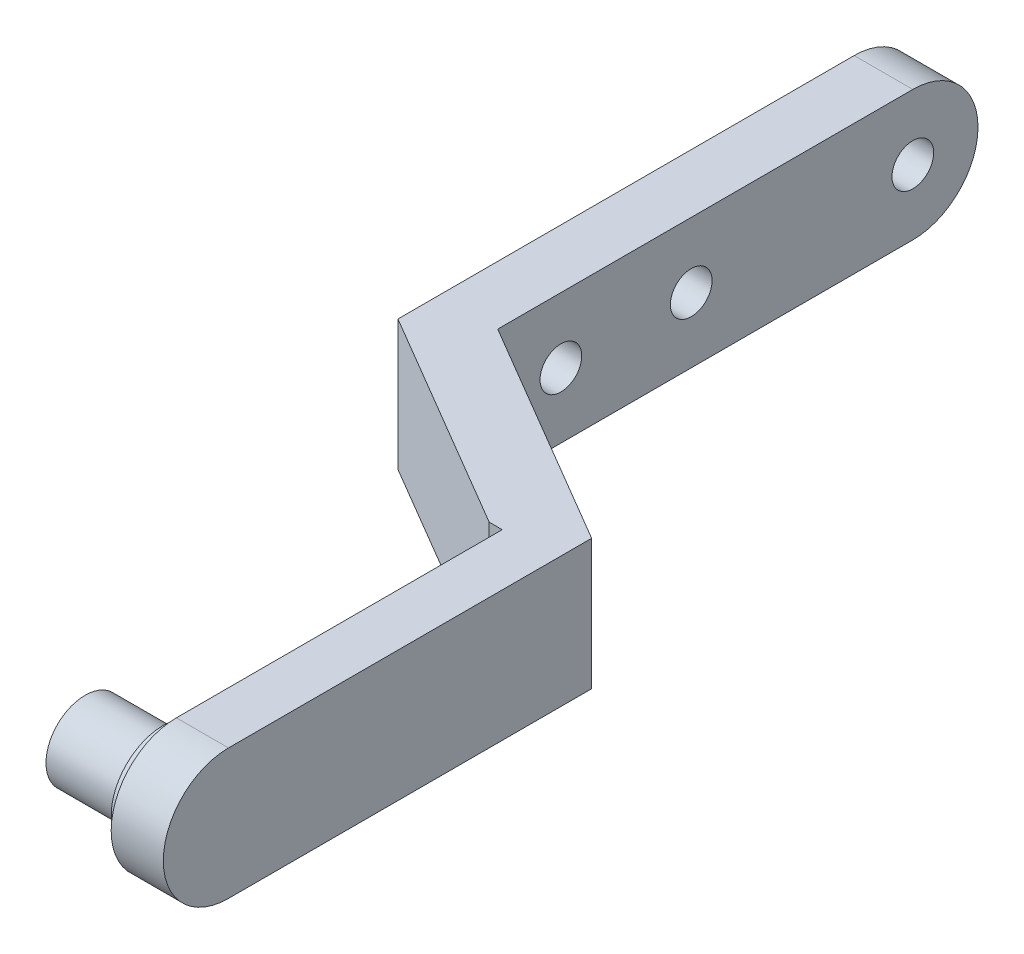
from build123d import *

# Parameters (mm, degrees)
EXTRUDE_2_DEPTH          = 5
CUT_EXTRUDE_1_DEPTH      = 83.044195407
CUT_EXTRUDE_1_DEPTH_BACK = 83.044195407
SKETCH_3_OUTSIDE_W       = 98.714
SKETCH_3_OUTSIDE_H       = 28.714
CUT_EXTRUDE_2_DEPTH      = 84.120394609
CUT_EXTRUDE_2_DEPTH_BACK = 84.120394609
SKETCH_4_R               = 1.6
SKETCH_5_R               = 3
EXTRUDE_4_DEPTH          = 6
CUT_EXTRUDE_3_DEPTH      = 82.939001702
CUT_EXTRUDE_3_DEPTH_BACK = 1
SKETCH_6_R               = 4


with BuildPart() as part:
    # 草图2 → 凸台-拉伸2 (new, symmetric)
    with BuildSketch(Plane(origin=(0, 0, 0), x_dir=(1, 0, 0), z_dir=(0, 1, 0))):
        Polygon((-17, 40), (0, 30), (0, 0), (5, 0), (5, 32.859730272), (-12.5, 43.153847919), (-12.5, 80), (-17, 80), align=None)
    extrude(amount=EXTRUDE_2_DEPTH, both=True)

    # 草图3 outside → 切除-拉伸1 (cut, two sides: drawn at the far end of the back side and taken through both)
    with BuildSketch(Plane(origin=(-12.5, 0, 0), x_dir=(0, 0, -1), z_dir=(1, 0, 0)).offset(-CUT_EXTRUDE_1_DEPTH_BACK)):
        with Locations((40, 0)):
            Rectangle(SKETCH_3_OUTSIDE_W, SKETCH_3_OUTSIDE_H)
        with BuildLine():
            Line((5, 5), (75, 5))
            ThreePointArc((75, 5), (80, 0), (75, -5))
            Line((75, -5), (5, -5))
            ThreePointArc((5, -5), (0, 0), (5, 5))
        make_face(mode=Mode.SUBTRACT)
    extrude(amount=CUT_EXTRUDE_1_DEPTH + CUT_EXTRUDE_1_DEPTH_BACK, mode=Mode.SUBTRACT)

    # 草图4 → 切除-拉伸2 (cut, two sides: drawn at the far end of the back side and taken through both)
    with BuildSketch(Plane(origin=(5, 0, 0), x_dir=(0, 0, -1), z_dir=(1, 0, 0)).offset(-CUT_EXTRUDE_2_DEPTH_BACK)):
        with Locations((75, 0)):
            Circle(SKETCH_4_R)
        with Locations((58, 0)):
            Circle(SKETCH_4_R)
        with Locations((48, 0)):
            Circle(SKETCH_4_R)
    extrude(amount=CUT_EXTRUDE_2_DEPTH + CUT_EXTRUDE_2_DEPTH_BACK, mode=Mode.SUBTRACT)

    # 草图5 → 凸台-拉伸4 (add)
    with BuildSketch(Plane.ZY):
        with Locations(Location((-5, 0, 0), (0, 0, 180))):
            Circle(SKETCH_5_R)
    extrude(amount=EXTRUDE_4_DEPTH)

    # 草图6 → 切除-拉伸3 (cut, two sides: drawn at the far end of the back side and taken through both)
    with BuildSketch(Plane.ZY.offset(-CUT_EXTRUDE_3_DEPTH_BACK)):
        with BuildLine():
            Line((-5, 5), (-30, 5))
            Line((-30, 5), (-30, -5))
            Line((-30, -5), (-5, -5))
            ThreePointArc((-5, -5), (0, 0), (-5, 5))
        make_face()
        with Locations(Location((-5, 0, 0), (0, 0, 180))):
            Circle(SKETCH_6_R, mode=Mode.SUBTRACT)
    extrude(amount=CUT_EXTRUDE_3_DEPTH + CUT_EXTRUDE_3_DEPTH_BACK, mode=Mode.SUBTRACT)


solid = part.part
